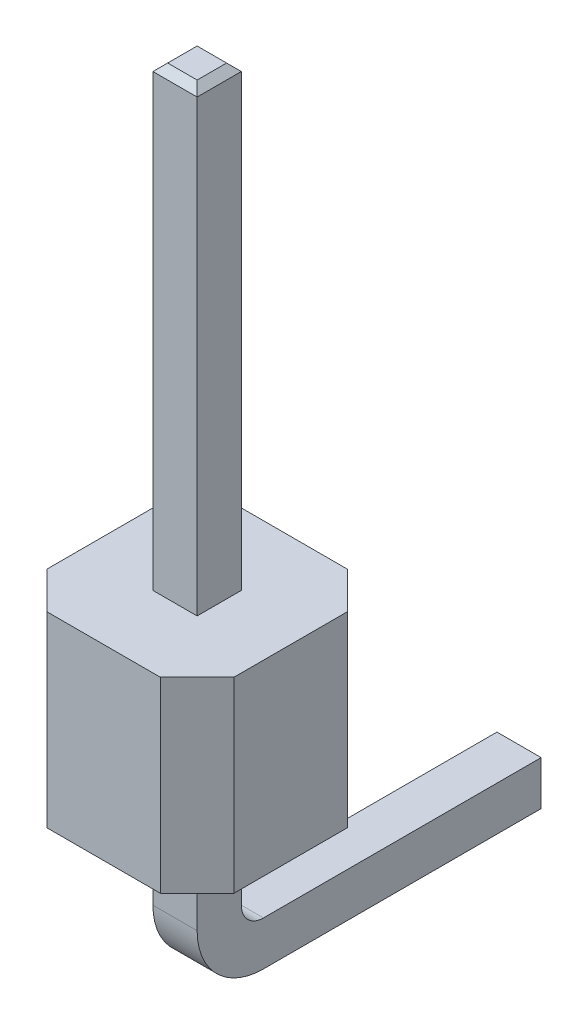
from build123d import *

# Parameters (mm, degrees)
CONTACT_DEPTH = 0.3
CHAMFER1_SIZE = 0.1
PLASTIC_DEPTH = 2.54


with BuildPart() as part:
    # Sketch2 → Contact (new, symmetric)
    with BuildSketch(Plane(origin=(0, 0, 0), x_dir=(0, -1, 0), z_dir=(1, 0, 0))):
        with BuildLine():
            Line((0.3, 3.2), (-0.3, 3.2))
            Line((-0.3, 3.2), (-0.3, -0.67))
            ThreePointArc((-0.3, -0.67), (-0.387867966, -0.882132034), (-0.6, -0.97))
            Line((-0.6, -0.97), (-10.5, -0.97))
            Line((-10.5, -0.97), (-10.5, -1.57))
            Line((-10.5, -1.57), (-0.6, -1.57))
            ThreePointArc((-0.6, -1.57), (0.036396103, -1.306396103), (0.3, -0.67))
            Line((0.3, -0.67), (0.3, 3.2))
        make_face()
    extrude(amount=CONTACT_DEPTH, both=True)

    # Chamfer1
    chamfer1_edges = [part.edges().sort_by_distance(p)[0] for p in [
        (0.3, 10.5, 1.27),
        (0, 0.3, -3.2),
        (0, -0.3, -3.2),
        (0, 10.5, 1.57),
        (0, 10.5, 0.97),
        (0.3, 0, -3.2),
        (-0.3, 0, -3.2),
        (-0.3, 10.5, 1.27),
    ]]
    chamfer(chamfer1_edges, length=CHAMFER1_SIZE)

    # Sketch1 → Plastic (add)
    with BuildSketch(Plane(origin=(0, 4.3, 0), x_dir=(0, 0, -1), z_dir=(0, 1, 0))):
        Polygon((-2.04, 1.27), (-0.5, 1.27), (0, 0.77), (0, -0.77), (-0.5, -1.27), (-2.04, -1.27), (-2.54, -0.77), (-2.54, 0.77), align=None)
    extrude(amount=-PLASTIC_DEPTH)


solid = part.part
